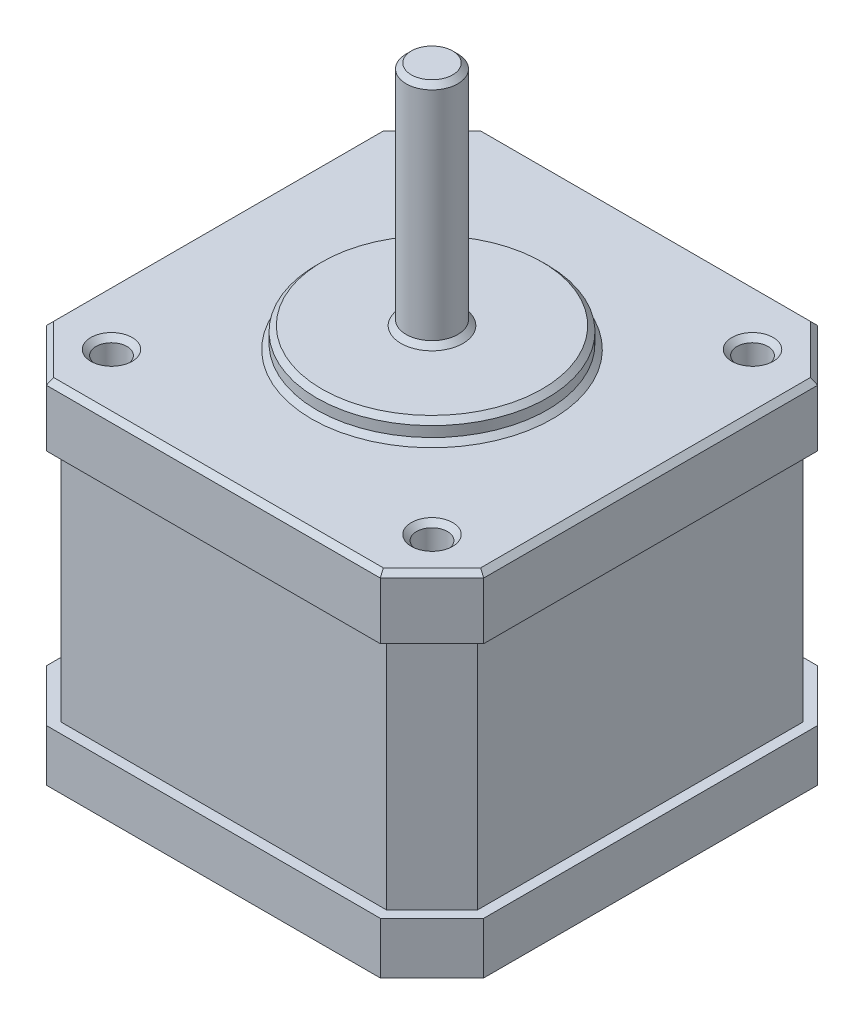
from build123d import *

# Parameters (mm, degrees)
EXTRUDE_1_DEPTH     = 34
SKETCH_1_3_R        = 1.5
CUT_EXTRUDE_1_DEPTH = 4.5
SKETCH_1_4_R        = 11.15
SKETCH_1_4_R_2      = 2.5
EXTRUDE_2_DEPTH     = 2
SKETCH_1_5_R        = 2.5
EXTRUDE_3_DEPTH     = 24
CHAMFER_1_SIZE      = 0.5
CUT_EXTRUDE_2_DEPTH = 23


with BuildPart() as part:
    # 스케치1 → 보스-돌출1 (new body)
    with BuildSketch(Plane(origin=(0, 0, 0), x_dir=(1, 0, 0), z_dir=(0, 1, 0))):
        Polygon((-16.15, 21.15), (-21.15, 16.15), (-21.15, -16.15), (-16.15, -21.15), (16.15, -21.15), (21.15, -16.15), (21.15, 16.15), (16.15, 21.15), align=None)
    extrude(amount=-EXTRUDE_1_DEPTH)

    # 스케치1<3> → 컷-돌출1 (cut)
    with BuildSketch(Plane(origin=(0, 0, 0), x_dir=(1, 0, 0), z_dir=(0, 1, 0))):
        with Locations((-15.5, 15.5)):
            Circle(SKETCH_1_3_R)
        with Locations((15.5, 15.5)):
            Circle(SKETCH_1_3_R)
        with Locations((15.5, -15.5)):
            Circle(SKETCH_1_3_R)
        with Locations((-15.5, -15.5)):
            Circle(SKETCH_1_3_R)
    extrude(amount=-CUT_EXTRUDE_1_DEPTH, mode=Mode.SUBTRACT)

    # 스케치1<4> → 보스-돌출2 (add)
    with BuildSketch(Plane(origin=(0, 0, 0), x_dir=(1, 0, 0), z_dir=(0, 1, 0))):
        Circle(SKETCH_1_4_R)
        Circle(SKETCH_1_4_R_2, mode=Mode.SUBTRACT)
    extrude(amount=EXTRUDE_2_DEPTH)

    # 스케치1<5> → 보스-돌출3 (add)
    with BuildSketch(Plane(origin=(0, 0, 0), x_dir=(1, 0, 0), z_dir=(0, 1, 0))):
        Circle(SKETCH_1_5_R)
    extrude(amount=EXTRUDE_3_DEPTH)

    # 모따기1
    chamfer_1_edges = [part.edges().sort_by_distance(p)[0] for p in [
        (-2.5, 24, 0),
        (-11.15, 2, 0),
        (-2.5, 2, 0),
        (-11.15, 0, 0),
        (14, 0, 15.5),
        (-17, 0, 15.5),
        (-17, 0, -15.5),
        (-18.65, 0, -18.65),
        (0, 0, -21.15),
        (18.65, 0, -18.65),
        (21.15, 0, 0),
        (18.65, 0, 18.65),
        (0, 0, 21.15),
        (-18.65, 0, 18.65),
        (-21.15, 0, 0),
        (14, 0, -15.5),
    ]]
    chamfer(chamfer_1_edges, length=CHAMFER_1_SIZE)

    # 스케치2 → 컷-돌출2 (cut)
    with BuildSketch(Plane(origin=(0, -29, 0), x_dir=(-1, 0, 0), z_dir=(0, -1, 0))):
        Polygon((21.15, -16.15), (21.15, 16.15), (16.15, 21.15), (-16.15, 21.15), (-21.15, 16.15), (-21.15, -16.15), (-16.15, -21.15), (16.15, -21.15), align=None)
        Polygon((20.15, -15.735786438), (20.15, 15.735786438), (15.735786438, 20.15), (-15.735786438, 20.15), (-20.15, 15.735786438), (-20.15, -15.735786438), (-15.735786438, -20.15), (15.735786438, -20.15), align=None, mode=Mode.SUBTRACT)
    extrude(amount=-CUT_EXTRUDE_2_DEPTH, mode=Mode.SUBTRACT)


solid = part.part
